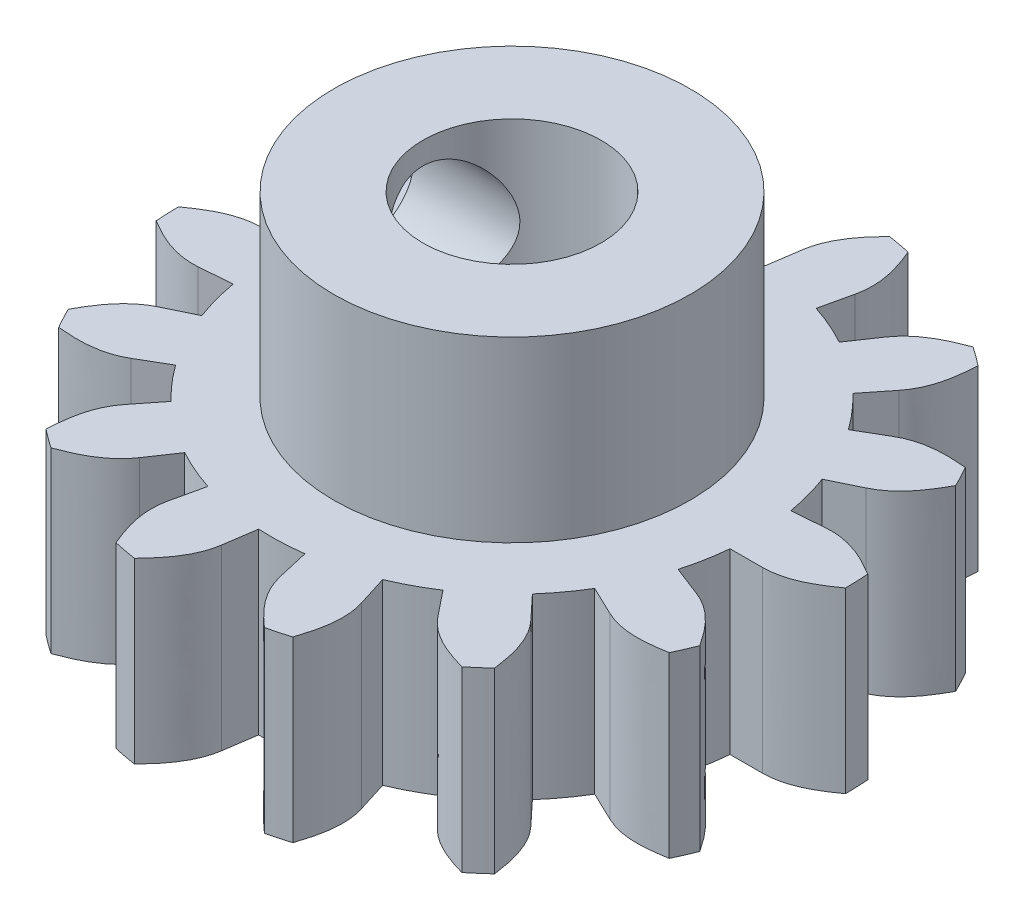
from build123d import *

# Parameters (mm, degrees)
BOSS_EXTRUDE1_DEPTH = 5
BOSS_EXTRUDE2_DEPTH = 5
CIRPATTERN1_COUNT   = 14
SKETCH4_R           = 2.5
CUT_EXTRUDE1_DEPTH  = 10
BOSS_EXTRUDE3_START = 5
SKETCH5_R           = 5
SKETCH5_R_2         = 2.5
BOSS_EXTRUDE3_DEPTH = 5
SKETCH6_R           = 1.875
CUT_EXTRUDE2_DEPTH  = 5


with BuildPart() as part:
    # Sketch2 → Boss-Extrude1 (new body)
    with BuildSketch(Plane(origin=(0, 0, 0), x_dir=(1, 0, 0), z_dir=(0, 1, 0))):
        with BuildLine():
            Line((6.665168834, 1.158041521), (7.578427396, 1.230000519))
            add(Edge.make_bspline(
                [(7.578427396, 1.230000519), (8.209904784, 1.279756943), (8.770296344, 1.009541074), (9.282823364, 0.699469546)],
                knots=[0, 0, 0, 0, 1, 1, 1, 1], degree=3))
            ThreePointArc((9.282823364, 0.699469546), (9.301628321, 0.373868743), (9.309016143, 0.04780904))
            add(Edge.make_bspline(
                [(7.652697797, -0.617802156), (8.286131468, -0.616716869), (8.823028243, -0.302396699), (9.309016143, 0.04780904)],
                knots=[0, 0, 0, 0, 1, 1, 1, 1], degree=3))
            Line((7.652697797, -0.617802156), (6.736610009, -0.619371727))
            ThreePointArc((6.736610009, -0.619371727), (6.759564964, 0.271693296), (6.665168834, 1.158041521))
        make_face()
    boss_extrude1 = extrude(amount=BOSS_EXTRUDE1_DEPTH)

    # Sketch3 → Boss-Extrude2 (add)
    with BuildSketch(Plane(origin=(0, 0, 0), x_dir=(1, 0, 0), z_dir=(0, 1, 0))):
        with BuildLine():
            ThreePointArc((6.765022967, 0), (6.740013204, 0.581169298), (6.665168834, 1.158041521))
            ThreePointArc((6.665168834, 1.158041521), (-6.759564964, -0.271693296), (6.736610009, -0.619371727))
            ThreePointArc((6.736610009, -0.619371727), (6.757915995, -0.310011545), (6.765022967, 0))
        make_face()
    extrude(amount=BOSS_EXTRUDE2_DEPTH)

    # CirPattern1: Boss-Extrude1 ×14 about axis
    cirpattern1_axis = Axis((0, 5, 0), (0, -1, 0))
    for i in range(1, CIRPATTERN1_COUNT):
        add(boss_extrude1.rotate(cirpattern1_axis, i * 360 / CIRPATTERN1_COUNT))

    # Sketch4 → Cut-Extrude1 (cut)
    with BuildSketch(Plane(origin=(0, 5, 0), x_dir=(1, 0, 0), z_dir=(0, 1, 0))):
        with Locations(Location((0, 0, 0), (0, 0, 270))):
            Circle(SKETCH4_R)
    extrude(amount=-CUT_EXTRUDE1_DEPTH, mode=Mode.SUBTRACT)

    # Sketch5 → Boss-Extrude3 (add)
    with BuildSketch(Plane(origin=(0, 5, 0), x_dir=(1, 0, 0), z_dir=(0, 1, 0)).offset(BOSS_EXTRUDE3_START)):
        with Locations(Location((0, 0, 0), (0, 0, 270))):
            Circle(SKETCH5_R)
        with Locations(Location((0, 0, 0), (0, 0, 270))):
            Circle(SKETCH5_R_2, mode=Mode.SUBTRACT)
    extrude(amount=-BOSS_EXTRUDE3_DEPTH)

    # Sketch6 → Cut-Extrude2 (cut)
    with BuildSketch(Plane(origin=(0, 0, 0), x_dir=(0, 0, -1), z_dir=(1, 0, 0))):
        with Locations((0, 7.5)):
            Circle(SKETCH6_R)
    extrude(amount=-CUT_EXTRUDE2_DEPTH, mode=Mode.SUBTRACT)


solid = part.part
